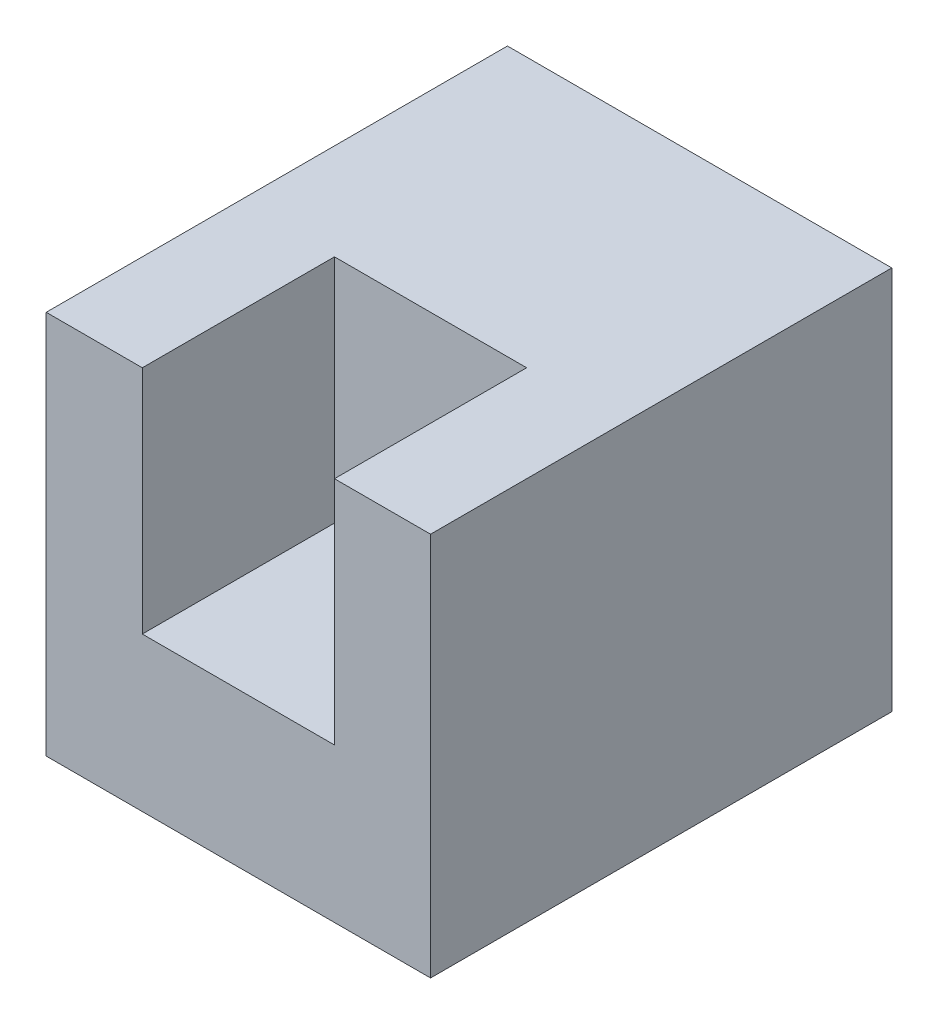
from build123d import *

# Parameters (mm, degrees)
SKETCH1_W           = 12.7
SKETCH1_H           = 12.7
BOSS_EXTRUDE1_DEPTH = 15.24
SKETCH2_W           = 6.35
SKETCH2_H           = 7.62
CUT_EXTRUDE1_DEPTH  = 6.35
SKETCH3_W           = 3.302040176
SKETCH3_H           = 3.302040176
CUT_EXTRUDE2_DEPTH  = 5.08


with BuildPart() as part:
    # Sketch1 → Boss-Extrude1 (new body)
    with BuildSketch(Plane.XY):
        Rectangle(SKETCH1_W, SKETCH1_H)
    extrude(amount=BOSS_EXTRUDE1_DEPTH)

    # Sketch2 → Cut-Extrude1 (cut)
    with BuildSketch(Plane.XY.offset(15.24)):
        with Locations((0, 2.54)):
            Rectangle(SKETCH2_W, SKETCH2_H)
    extrude(amount=-CUT_EXTRUDE1_DEPTH, mode=Mode.SUBTRACT)

    # Sketch3 → Cut-Extrude2 (cut)
    with BuildSketch(Plane(origin=(0, 0, 0), x_dir=(-1, 0, 0), z_dir=(0, 0, -1))):
        Rectangle(SKETCH3_W, SKETCH3_H)
    extrude(amount=-CUT_EXTRUDE2_DEPTH, mode=Mode.SUBTRACT)


solid = part.part
